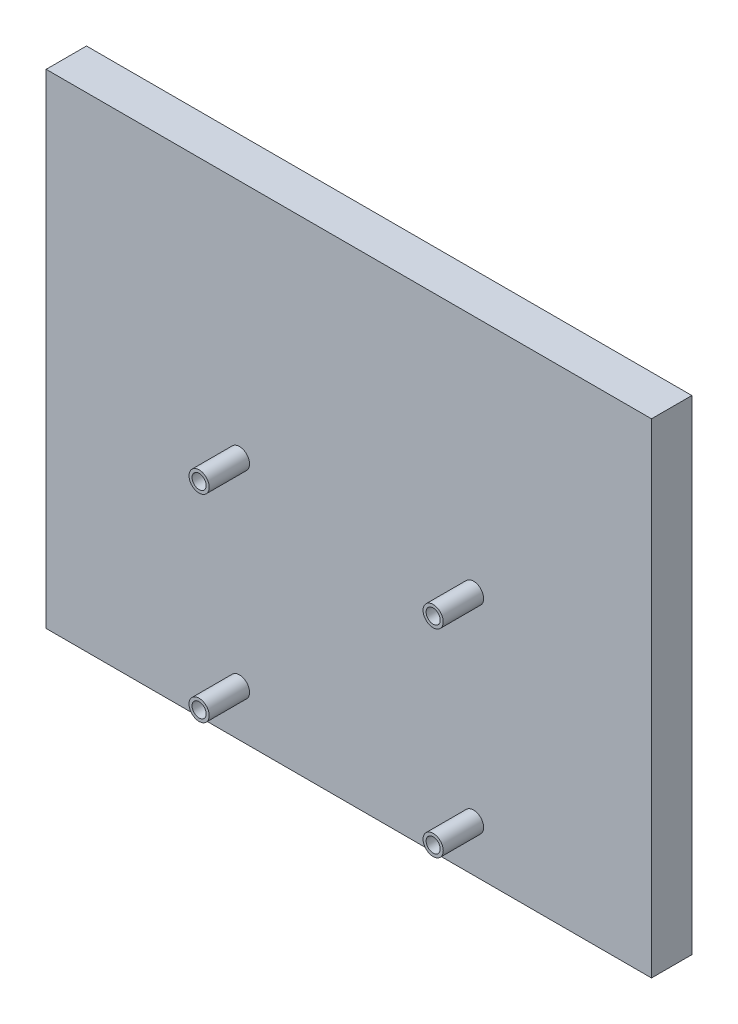
from build123d import *

# Parameters (mm, degrees)
SKETCH1_W               = 150
SKETCH1_H               = 120
BOSS_EXTRUDE1_DEPTH     = 10
SKETCH2_R               = 4
CUT_EXTRUDE1_DEPTH      = 30
CROQUIS4_R              = 2.5
SALIENTE_EXTRUIR2_DEPTH = 10
CROQUIS5_R              = 1.75
CORTAR_EXTRUIR1_DEPTH   = 9


with BuildPart() as part:
    # Sketch1 → Boss-Extrude1 (new body)
    with BuildSketch(Plane.XY):
        with Locations((75, 0)):
            Rectangle(SKETCH1_W, SKETCH1_H)
    extrude(amount=BOSS_EXTRUDE1_DEPTH)

    # Sketch2 → Cut-Extrude1 (cut)
    with BuildSketch(Plane.ZY):
        with Locations((5, 0)):
            Circle(SKETCH2_R)
        with Locations((5, 30)):
            Circle(SKETCH2_R)
        with Locations((5, -30)):
            Circle(SKETCH2_R)
    extrude(amount=-CUT_EXTRUDE1_DEPTH, mode=Mode.SUBTRACT)

    # Croquis4 → Saliente-Extruir2 (add)
    with BuildSketch(Plane.XY.offset(10)):
        with Locations((47.900115216, 0.5)):
            Circle(CROQUIS4_R)
        with Locations((105.9, 0.615607451)):
            Circle(CROQUIS4_R)
        with Locations((105.9, -48.5)):
            Circle(CROQUIS4_R)
        with Locations((47.900115216, -48.5)):
            Circle(CROQUIS4_R)
    extrude(amount=SALIENTE_EXTRUIR2_DEPTH)

    # Croquis5 → Cortar-Extruir1 (cut)
    with BuildSketch(Plane.XY.offset(20)):
        with Locations((47.900115216, 0.5)):
            Circle(CROQUIS5_R)
        with Locations((47.900115216, -48.5)):
            Circle(CROQUIS5_R)
        with Locations((105.9, -48.5)):
            Circle(CROQUIS5_R)
        with Locations((105.9, 0.615607451)):
            Circle(CROQUIS5_R)
    extrude(amount=-CORTAR_EXTRUIR1_DEPTH, mode=Mode.SUBTRACT)


solid = part.part
